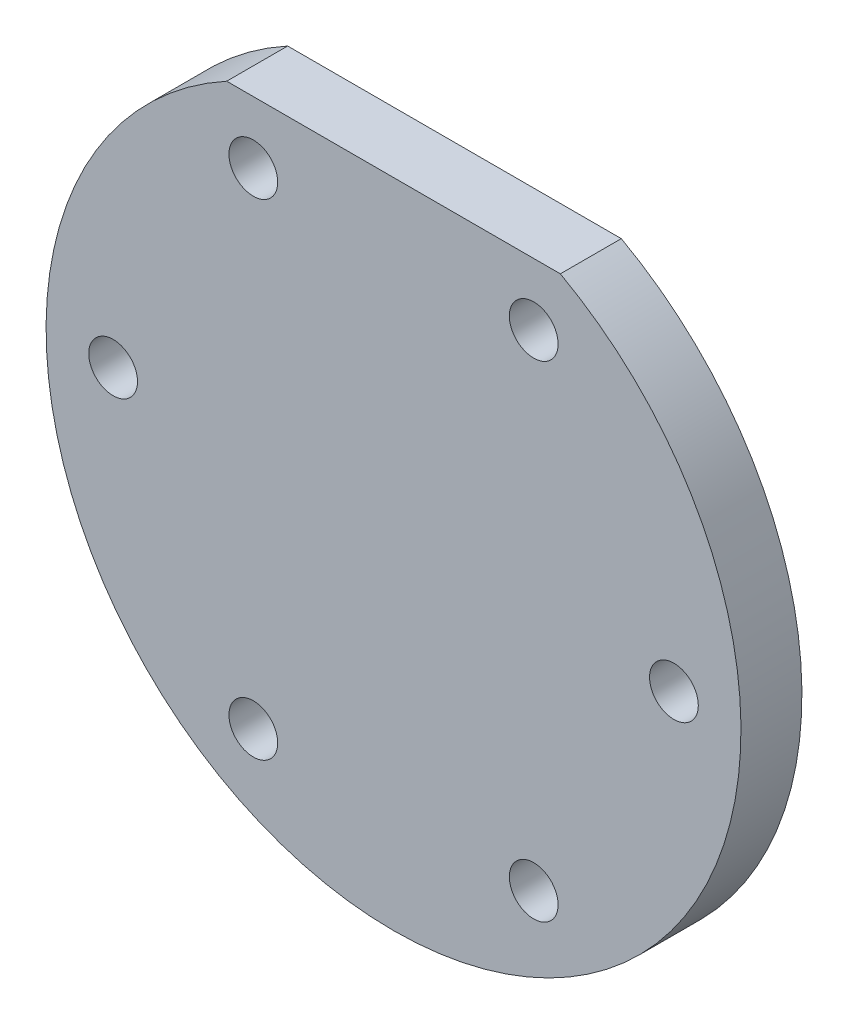
from build123d import *

# Parameters (mm, degrees)
SKETCH_1_R      = 2
EXTRUDE_1_DEPTH = 5


with BuildPart() as part:
    # 草图1 → 凸台-拉伸1 (new body)
    with BuildSketch(Plane.XY):
        with BuildLine():
            Line((-13.683932183, 25), (13.683932183, 25))
            ThreePointArc((13.683932183, 25), (0, -28.5), (-13.683932183, 25))
        make_face()
        with Locations((23, 0)):
            Circle(SKETCH_1_R, mode=Mode.SUBTRACT)
        with Locations((11.5, -19.918584287)):
            Circle(SKETCH_1_R, mode=Mode.SUBTRACT)
        with Locations((-11.5, -19.918584287)):
            Circle(SKETCH_1_R, mode=Mode.SUBTRACT)
        with Locations((-23, 0)):
            Circle(SKETCH_1_R, mode=Mode.SUBTRACT)
        with Locations((-11.5, 19.918584287)):
            Circle(SKETCH_1_R, mode=Mode.SUBTRACT)
        with Locations((11.5, 19.918584287)):
            Circle(SKETCH_1_R, mode=Mode.SUBTRACT)
    extrude(amount=EXTRUDE_1_DEPTH)


solid = part.part
